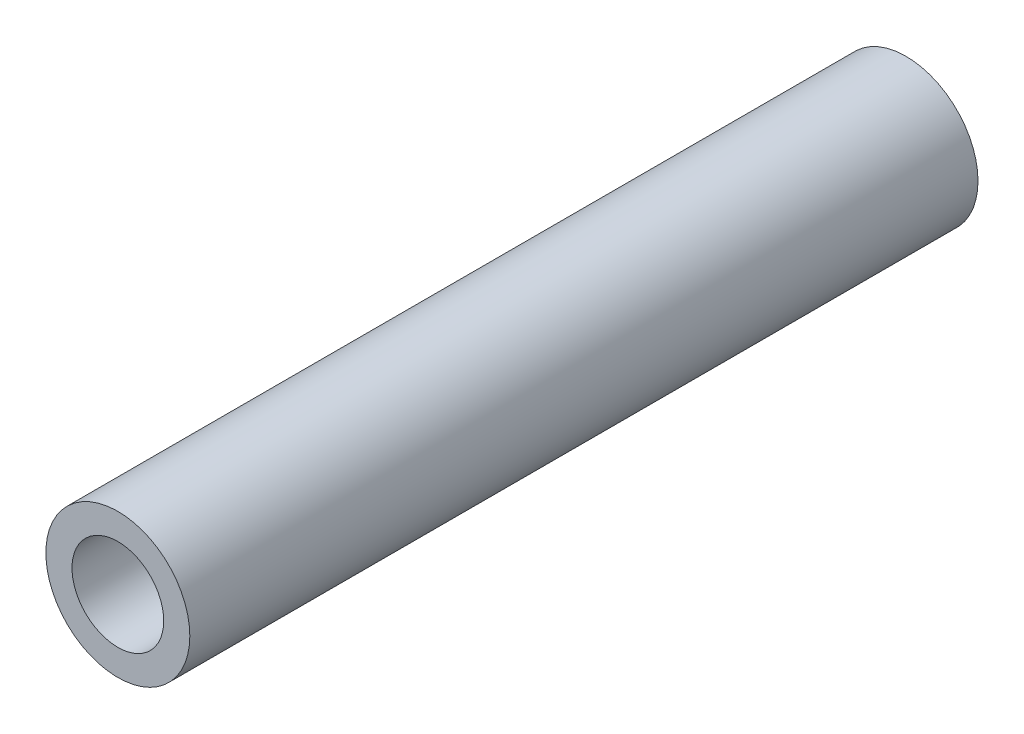
from build123d import *

# Parameters (mm, degrees)
S01_OPEN_STEEL_CORE_BORE_R      = 2.7
S01_OPEN_STEEL_CORE_BORE_R_2    = 1.72
F_01_OPEN_STEEL_CORE_BORE_DEPTH = 29.564941753


with BuildPart() as part:
    # S01 - Open steel core bore → 01 - Open steel core bore (new body)
    with BuildSketch(Plane.XY):
        Circle(S01_OPEN_STEEL_CORE_BORE_R)
        Circle(S01_OPEN_STEEL_CORE_BORE_R_2, mode=Mode.SUBTRACT)
    extrude(amount=F_01_OPEN_STEEL_CORE_BORE_DEPTH)


solid = part.part
